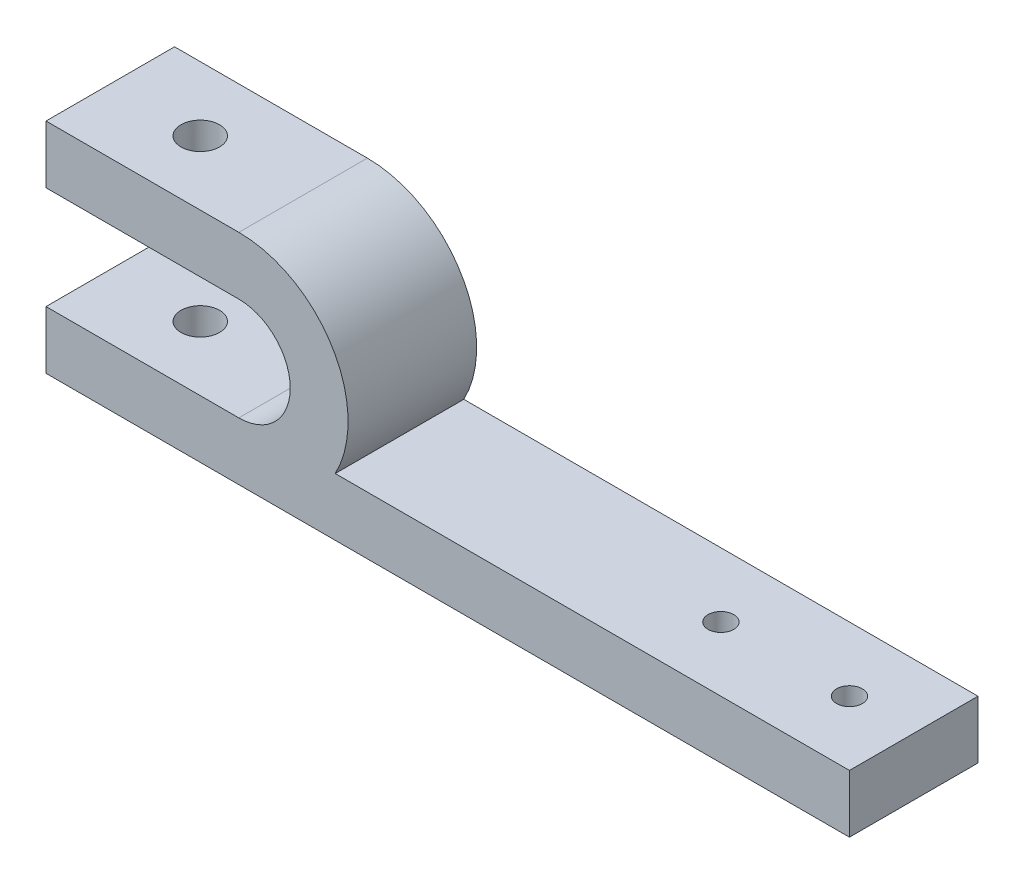
from build123d import *

# Parameters (mm, degrees)
SALIENTE_EXTRUIR1_DEPTH = 10
CROQUIS2_R              = 1
CROQUIS2_R_2            = 1.5
CORTAR_EXTRUIR1_DEPTH   = 52.431993934


with BuildPart() as part:
    # Croquis1 → Saliente-Extruir1 (new body)
    with BuildSketch(Plane.XY):
        with BuildLine():
            Line((0, 4), (-15, 4))
            Line((-15, 4), (-15, 8.5))
            Line((-15, 8.5), (0, 8.5))
            ThreePointArc((0, 8.5), (7.288689869, 4.373213921), (7.5, -4))
            Line((7.5, -4), (47.5, -4))
            Line((47.5, -4), (47.5, -8.5))
            Line((47.5, -8.5), (-15, -8.5))
            Line((-15, -8.5), (-15, -4))
            Line((-15, -4), (0, -4))
            ThreePointArc((0, -4), (4, 0), (0, 4))
        make_face()
    extrude(amount=SALIENTE_EXTRUIR1_DEPTH)

    # Croquis2 → Cortar-Extruir1 (cut, through all)
    with BuildSketch(Plane.XZ.offset(8.5)):
        with Locations((42.5, 5)):
            Circle(CROQUIS2_R)
        with Locations((32.5, 5)):
            Circle(CROQUIS2_R)
        with Locations((-8, 5)):
            Circle(CROQUIS2_R_2)
    extrude(amount=-CORTAR_EXTRUIR1_DEPTH, mode=Mode.SUBTRACT)


solid = part.part
